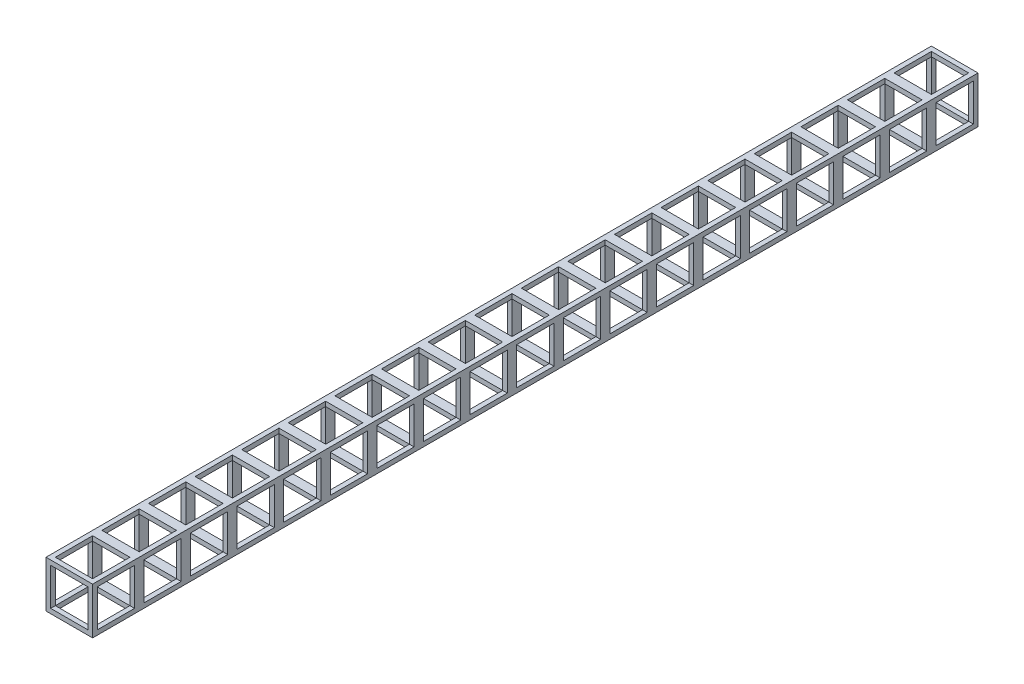
from build123d import *

# Parameters (mm, degrees)
SKIZZE1_W                       = 50
SKIZZE1_H                       = 50
AUFSATZ_LINEAR_AUSTRAGEN1_DEPTH = 950
SKIZZE2_W                       = 40
SKIZZE2_H                       = 40
SCHNITT_LINEAR_AUSTRAGEN1_DEPTH = 953.627944163
SKIZZE3_W                       = 40
SKIZZE3_H                       = 40
SCHNITT_LINEAR_AUSTRAGEN2_DEPTH = 953.627944163
LINEARES_MUSTER1_COUNT          = 19
LINEARES_MUSTER1_PITCH          = 50
SKIZZE4_W                       = 40
SKIZZE4_H                       = 40
SCHNITT_LINEAR_AUSTRAGEN3_DEPTH = 953.627944163
LINEARES_MUSTER2_COUNT          = 19
LINEARES_MUSTER2_PITCH          = 50


with BuildPart() as part:
    # Skizze1 → Aufsatz-Linear austragen1 (new body)
    with BuildSketch(Plane.XY):
        with Locations((25, 25)):
            Rectangle(SKIZZE1_W, SKIZZE1_H)
    extrude(amount=AUFSATZ_LINEAR_AUSTRAGEN1_DEPTH)

    # Skizze2 → Schnitt-Linear austragen1 (cut, through all)
    with BuildSketch(Plane(origin=(0, 0, 0), x_dir=(-1, 0, 0), z_dir=(0, 0, -1))):
        with Locations((-25, 25)):
            Rectangle(SKIZZE2_W, SKIZZE2_H)
    extrude(amount=-SCHNITT_LINEAR_AUSTRAGEN1_DEPTH, mode=Mode.SUBTRACT)

    # Skizze3 → Schnitt-Linear austragen2 (cut, symmetric)
    with BuildSketch(Plane.ZY):
        with Locations((25, 25)):
            Rectangle(SKIZZE3_W, SKIZZE3_H)
    schnitt_linear_austragen2 = extrude(amount=SCHNITT_LINEAR_AUSTRAGEN2_DEPTH, both=True, mode=Mode.SUBTRACT)

    # Lineares Muster1: Schnitt-Linear austragen2 ×19
    with Locations(*[(0, 0, i * LINEARES_MUSTER1_PITCH) for i in range(1, LINEARES_MUSTER1_COUNT)]):
        add(schnitt_linear_austragen2, mode=Mode.SUBTRACT)

    # Skizze4 → Schnitt-Linear austragen3 (cut, symmetric)
    with BuildSketch(Plane(origin=(0, 50, 0), x_dir=(1, 0, 0), z_dir=(0, 1, 0))):
        with Locations((25, -25)):
            Rectangle(SKIZZE4_W, SKIZZE4_H)
    schnitt_linear_austragen3 = extrude(amount=SCHNITT_LINEAR_AUSTRAGEN3_DEPTH, both=True, mode=Mode.SUBTRACT)

    # Lineares Muster2: Schnitt-Linear austragen3 ×19
    with Locations(*[(0, 0, i * LINEARES_MUSTER2_PITCH) for i in range(1, LINEARES_MUSTER2_COUNT)]):
        add(schnitt_linear_austragen3, mode=Mode.SUBTRACT)


solid = part.part
